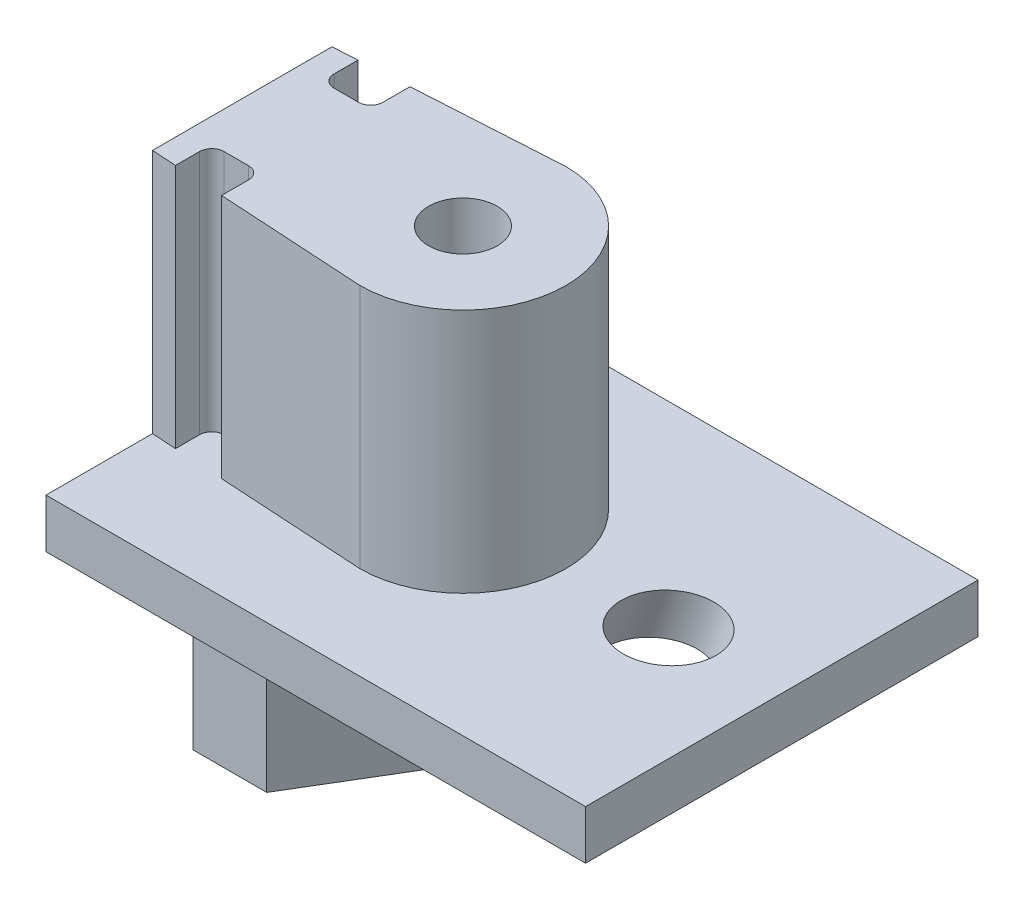
from build123d import *

# Parameters (mm, degrees)
BOSS_EXTRUDE1_DEPTH     = 2.5
SKETCH4_R               = 0.35
THROUGH_HOLES_DEPTH     = 4.688156721
FILLET1_R               = 0.125
SKETCH5_R               = 0.125
BOSS_EXTRUDE2_DEPTH     = 0.5
SKETCH8_R               = 0.46
CUT_EXTRUDE1_DEPTH      = 5.582575695
CUT_EXTRUDE2_DEPTH      = 5.562071898
CUT_EXTRUDE2_DEPTH_BACK = 5.562071898
SKETCH9_W               = 1.465031661
SKETCH9_H               = 4
BOSS_EXTRUDE3_DEPTH     = 1.75


with BuildPart() as part:
    # Sketch3 → Boss-Extrude1 (new body)
    with BuildSketch(Plane(origin=(0, 0, 0), x_dir=(1, 0, 0), z_dir=(0, 1, 0))):
        with BuildLine():
            Line((-2.5, 0.9), (-2, 0.93))
            Line((-2, 0.93), (-2, 0.56))
            Line((-2, 0.56), (-1.5, 0.56))
            Line((-1.5, 0.56), (-1.5, 0.96))
            Line((-1.5, 0.96), (0, 1.05))
            ThreePointArc((0, 1.05), (1.05, 0), (0, -1.05))
            Line((0, -1.05), (-1.5, -0.96))
            Line((-1.5, -0.96), (-1.5, -0.56))
            Line((-1.5, -0.56), (-2, -0.56))
            Line((-2, -0.56), (-2, -0.93))
            Line((-2, -0.93), (-2.5, -0.9))
            Line((-2.5, -0.9), (-2.5, 0.9))
        make_face()
    extrude(amount=BOSS_EXTRUDE1_DEPTH)

    # Sketch4 → Through Holes (cut, through all)
    with BuildSketch(Plane(origin=(0, 2.5, 0), x_dir=(1, 0, 0), z_dir=(0, 1, 0))):
        with Locations(Location((0, 0, 0), (0, 0, 270))):
            Circle(SKETCH4_R)
    extrude(amount=-THROUGH_HOLES_DEPTH, mode=Mode.SUBTRACT)

    # Fillet1
    fillet1_edges = [part.edges().sort_by_distance(p)[0] for p in [
        (-2, 1.25, -0.56),
        (-1.5, 1.25, -0.56),
        (-1.5, 1.25, 0.56),
        (-2, 1.25, 0.56),
    ]]
    fillet(fillet1_edges, radius=FILLET1_R)

    # Sketch5 → Boss-Extrude2 (add)
    with BuildSketch(Plane(origin=(0, 0, 0), x_dir=(1, 0, 0), z_dir=(0, 1, 0))):
        Polygon((-2.25, -2), (1.75, -2), (3.25, -2), (3.25, 2), (1.75, 2), (-2.25, 2), align=None)
        with Locations(Location((0, 0, 0), (0, 0, 270))):
            Circle(SKETCH5_R, mode=Mode.SUBTRACT)
    extrude(amount=-BOSS_EXTRUDE2_DEPTH)

    # Sketch8 → Cut-Extrude1 (cut, through all)
    with BuildSketch(Plane(origin=(0.7, 2.1, 0), x_dir=(0.948683298050514, -0.3162277660168378, 0), z_dir=(0.3162277660168378, 0.948683298050514, 0))):
        with Locations((1.987936011, 0)):
            Circle(SKETCH8_R)
    extrude(amount=-CUT_EXTRUDE1_DEPTH, mode=Mode.SUBTRACT)

    # Sketch9 → Cut-Extrude2 (cut, two sides: drawn at the far end of the back side and taken through both)
    with BuildSketch(Plane.XZ.offset(-CUT_EXTRUDE2_DEPTH_BACK)):
        with Locations((-2.982515831, 0)):
            Rectangle(SKETCH9_W, SKETCH9_H)
    extrude(amount=CUT_EXTRUDE2_DEPTH + CUT_EXTRUDE2_DEPTH_BACK, mode=Mode.SUBTRACT)

    # Sketch10 → Boss-Extrude3 (add)
    with BuildSketch(Plane.XZ.offset(0.5)):
        Polygon((-1.5, 1.25), (-1.5, -1.25), (-0.75, -1.25), (0, 0), (-0.75, 1.25), align=None)
    extrude(amount=BOSS_EXTRUDE3_DEPTH)


solid = part.part
